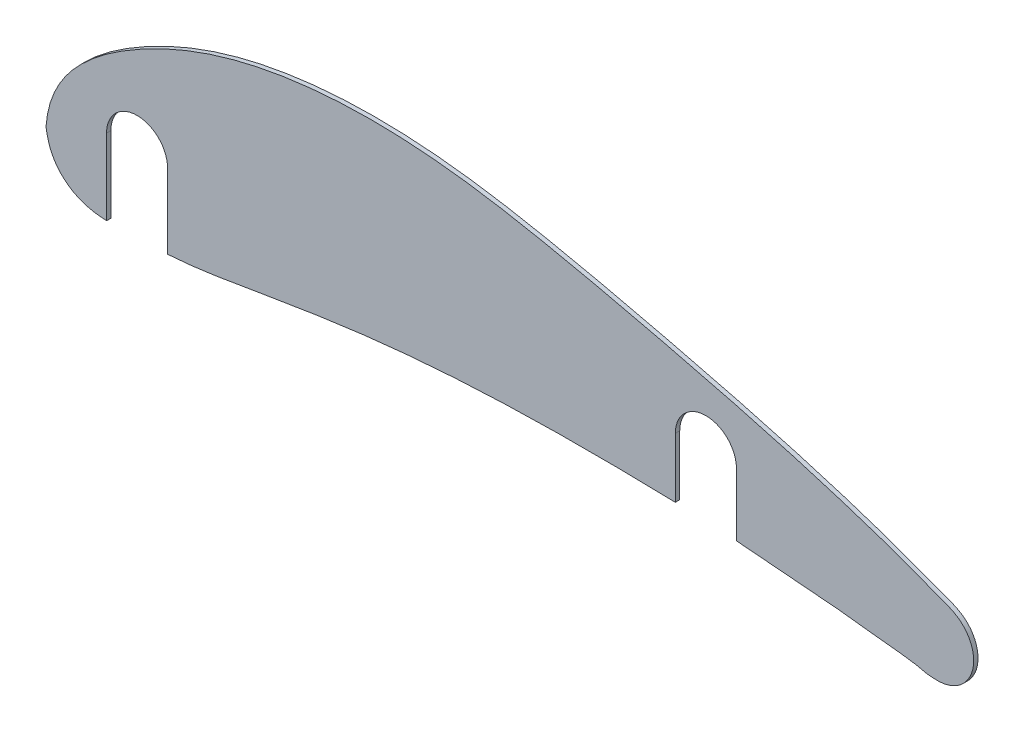
from build123d import *

# Parameters (mm, degrees)
BOSS_EXTRUDE1_DEPTH = 1.5875
SKETCH2_R           = 5
CUT_EXTRUDE1_DEPTH  = 4
BOSS_EXTRUDE2_START = -1.5875
SKETCH3_R           = 5
BOSS_EXTRUDE2_DEPTH = 1.5875
CUT_EXTRUDE2_DEPTH  = 1.5875


with BuildPart() as part:
    # Sketch1 → Boss-Extrude1 (new body)
    with BuildSketch(Plane.XY):
        with BuildLine():
            add(Edge.make_bspline(
                [(0.000560351, 0.000130087), (0.810633127, 7.359196055), (8.649092025, 17.856605174), (26.286719818, 29.975176328), (52.111128271, 42.069215275), (89.597618475, 49.290763054), (131.400792109, 47.884831915), (173.256699242, 40.041104278), (217.961060472, 29.612974894), (256.952064401, 19.528920948), (290.35983767, 8.71099439), (301.273197721, 4.382828139), (314.816918223, -0.516206742), (309.846313895, 0.000130087)],
                knots=[0, 0, 0, 0, 0.060863618, 0.113688265, 0.188608742, 0.312908923, 0.448482434, 0.557612135, 0.691544113, 0.852438279, 0.92975597, 0.976058229, 1, 1, 1, 1], degree=3))
            add(Edge.make_bspline(
                [(309.846313895, 0.000130087), (303.956832565, 1.47095521), (293.989507544, 2.093987313), (276.26402299, 4.514356704), (260.846344817, 5.427413394), (235.858814759, 7.870306192), (205.101424636, 8.838080282), (157.718638092, 9.030650149), (110.497331172, 6.181495223), (66.506197185, -0.586669107), (36.454672816, -6.098499901), (15.316603331, -6.189065841), (1.230714189, -6.924076091), (0.000560351, 0.000130087)],
                knots=[0, 0, 0, 0, 0.057787081, 0.095274891, 0.171021118, 0.205339302, 0.335319146, 0.464904334, 0.658702312, 0.785511947, 0.893517288, 0.94309214, 1, 1, 1, 1], degree=3))
        make_face()
    extrude(amount=BOSS_EXTRUDE1_DEPTH)

    # Sketch2 → Cut-Extrude1 (cut)
    with BuildSketch(Plane.XY.offset(1.5875)):
        with Locations((227.296313895, 19.050130087)):
            Circle(SKETCH2_R)
        with Locations((20.32, 10.16)):
            Circle(SKETCH2_R)
    extrude(amount=-CUT_EXTRUDE1_DEPTH, mode=Mode.SUBTRACT)

    # Sketch3 → Boss-Extrude2 (add)
    # profile 1 of 2: a face of its own
    with BuildSketch(Plane(origin=(0, 0, 0), x_dir=(-1, 0, 0), z_dir=(0, 0, -1)).offset(BOSS_EXTRUDE2_START)):
        with BuildLine():
            add(Edge.make_bspline(
                [(-307.640659198, -12.539087546), (-307.217558356, -12.433423344), (-306.794698745, -12.325307987), (-305.94757969, -12.12330096), (-305.523307874, -12.029535003), (-304.248687144, -11.766580558), (-303.396542737, -11.615636043), (-300.835174159, -11.21295058), (-299.121107841, -11.010410608), (-295.688964286, -10.646085532), (-293.970839392, -10.484784679), (-291.395439154, -10.22467467), (-290.537293617, -10.134707532), (-288.822043271, -9.944198445), (-287.964861558, -9.844437915), (-285.39405881, -9.537612889), (-283.681197538, -9.322828465), (-280.253975137, -8.908499626), (-278.539352749, -8.711609867), (-273.38915432, -8.185272474), (-269.948888995, -7.903472556), (-263.065636854, -7.367525768), (-259.622642312, -7.113457385), (-252.743642855, -6.534299134), (-249.308438171, -6.201078142), (-242.431016007, -5.605893048), (-238.987786484, -5.354212306), (-232.093485223, -4.930535427), (-228.641544528, -4.75746758), (-218.28592219, -4.32759383), (-211.381766601, -4.15969745), (-197.573132458, -3.918001938), (-190.668647472, -3.846076469), (-176.859186388, -3.845312431), (-169.95421005, -3.916543553), (-156.143612339, -4.246938801), (-149.234937909, -4.505545645), (-135.436938869, -5.236314206), (-128.547026917, -5.708365191), (-114.787919071, -6.895625055), (-107.918875215, -7.612618486), (-94.20369313, -9.315463639), (-87.358999715, -10.294378281), (-77.115816219, -11.889039149), (-73.704718185, -12.441665778), (-66.887436207, -13.578332899), (-63.482024188, -14.167402421), (-53.261994425, -15.909749635), (-46.44242034, -17.028905731), (-37.85333306, -17.987330435), (-36.13227452, -18.1567188), (-32.688374655, -18.439324462), (-30.964736841, -18.550600806), (-25.789066845, -18.799813385), (-22.332836764, -18.861587488), (-18.013816177, -18.964564881), (-17.150036808, -18.986391339), (-15.422588421, -19.035533108), (-14.558961918, -19.064963111), (-12.831389771, -19.107949046), (-11.967435293, -19.121065622), (-10.238782943, -19.110322287), (-9.374285952, -19.086464893), (-6.799982642, -18.935774333), (-5.1040529, -18.729672307), (-2.60606507, -18.181294881), (-1.781028788, -17.958760916), (-0.556909532, -17.554948104), (-0.151110885, -17.40866523), (0.655628102, -17.090782411), (1.058151158, -16.918409424), (3.033598156, -15.999239459), (4.496819541, -15.083862947), (6.165080649, -13.692542546), (6.491819622, -13.400643282), (7.122036025, -12.797069108), (7.425020518, -12.486058415), (8.298329375, -11.525908236), (8.833114996, -10.8497312), (9.565071132, -9.782041168), (9.797325866, -9.417219923), (10.238211241, -8.669604442), (10.447401936, -8.285671349), (11.035029394, -7.114520562), (11.370477668, -6.315183997), (11.937470931, -4.682242599), (12.168952201, -3.848616751), (12.442464761, -2.573867952), (12.517450612, -2.143613721), (12.670167609, -1.284010684), (12.746526108, -0.854209165), (12.822884607, -0.424407646)],
                knots=[0, 0, 0, 0, 0.00390625, 0.00390625, 0.0078125, 0.0078125, 0.015625, 0.015625, 0.03125, 0.03125, 0.046875, 0.046875, 0.0546875, 0.0546875, 0.0625, 0.0625, 0.078125, 0.078125, 0.09375, 0.09375, 0.125, 0.125, 0.15625, 0.15625, 0.1875, 0.1875, 0.21875, 0.21875, 0.25, 0.25, 0.3125, 0.3125, 0.375, 0.375, 0.4375, 0.4375, 0.5, 0.5, 0.5625, 0.5625, 0.625, 0.625, 0.6875, 0.6875, 0.71875, 0.71875, 0.75, 0.75, 0.8125, 0.8125, 0.828125, 0.828125, 0.84375, 0.84375, 0.875, 0.875, 0.8828125, 0.8828125, 0.890625, 0.890625, 0.8984375, 0.8984375, 0.90625, 0.90625, 0.921875, 0.921875, 0.9296875, 0.9296875, 0.93359375, 0.93359375, 0.9375, 0.9375, 0.953125, 0.953125, 0.95703125, 0.95703125, 0.9609375, 0.9609375, 0.96875, 0.96875, 0.97265625, 0.97265625, 0.9765625, 0.9765625, 0.984375, 0.984375, 0.9921875, 0.9921875, 0.99609375, 0.99609375, 1, 1, 1, 1], degree=3))
            add(Edge.make_bspline(
                [(12.822884607, -0.424407646), (12.765139792, 0.100172261), (12.707394977, 0.624752169), (12.591905347, 1.673911984), (12.52891567, 2.197119212), (12.297914412, 3.755740267), (12.098640002, 4.782972021), (11.366701381, 7.829566749), (10.700090591, 9.813873371), (9.645780575, 12.236404594), (9.423338741, 12.719055064), (8.958881373, 13.673430352), (8.23447829, 15.08562207), (7.430656328, 16.442308561), (5.726221645, 19.088035245), (4.460833832, 20.761627444), (2.403164216, 23.160481023), (1.688839251, 23.943369949), (0.222028874, 25.466851836), (-2.030148044, 27.684033496), (-4.41064195, 29.733189538), (-9.316761854, 33.641457343), (-12.781484695, 35.992965612), (-18.164651713, 39.27656059), (-19.990377965, 40.333355187), (-23.666133339, 42.357961339), (-25.520275615, 43.327279207), (-31.130467721, 46.108995357), (-34.93418714, 47.795409072), (-46.531537172, 52.362569414), (-54.515154512, 54.741205672), (-63.744755219, 56.761657049), (-64.774723341, 56.977238408), (-66.834788658, 57.389176151), (-69.925830231, 57.978474657), (-73.019609651, 58.484766764), (-79.210596391, 59.393423564), (-83.34248448, 59.860835126), (-95.750370075, 60.892542115), (-104.038590609, 61.086258338), (-116.492008775, 60.737503457), (-120.646670589, 60.514458534), (-126.883586466, 60.030630314), (-128.963379302, 59.844466803), (-133.124550465, 59.424070644), (-135.207540526, 59.189544115), (-145.594970482, 57.905779676), (-153.832792977, 56.524741453), (-166.132564079, 54.17356844), (-170.223049115, 53.343512008), (-178.393757628, 51.633027655), (-182.473713838, 50.751287787), (-194.700002507, 48.039407471), (-202.832778155, 46.142719954), (-215.014339388, 43.211283588), (-219.072180538, 42.2209863), (-227.182053622, 40.211875691), (-231.232225779, 39.191799725), (-243.36199815, 36.064182322), (-251.420235834, 33.887176959), (-263.448276276, 30.428836901), (-267.447887219, 29.244406312), (-275.426612854, 26.808913408), (-279.40618455, 25.559336773), (-285.35715209, 23.625187338), (-287.337685563, 22.970320262), (-291.290499883, 21.633757462), (-293.262858235, 20.952313697), (-297.195026702, 19.548632822), (-299.153208366, 18.821101737), (-303.064502528, 17.349560104), (-305.0190352, 16.610166429), (-307.955050529, 15.51478285), (-308.934285457, 15.151485754), (-310.893891195, 14.428584226), (-311.875164589, 14.071914027), (-313.831366034, 13.337945403), (-314.808049131, 12.961388245), (-316.719156906, 12.12649388), (-317.652282104, 11.663851008), (-318.978024645, 10.820880812), (-319.408221872, 10.51489925), (-320.225847261, 9.859622762), (-320.615306755, 9.509314527), (-321.353583055, 8.761089941), (-321.699471113, 8.365825169), (-322.336708966, 7.543445692), (-322.629515882, 7.114906521), (-323.16319448, 6.222920138), (-323.404365456, 5.758838065), (-323.831166845, 4.79677466), (-324.194764938, 3.818521185), (-324.436422233, 2.809031523), (-324.571585545, 2.040110573), (-324.608939896, 1.781831147), (-324.667931422, 1.261246203), (-324.689573785, 0.998141034), (-324.756720117, -0.310913388), (-324.682639527, -1.346678633), (-324.382280636, -2.883329873), (-324.249021416, -3.39559158), (-323.924248204, -4.388644661), (-323.541036888, -5.35507277), (-323.0431311, -6.269244957), (-322.625572759, -6.934768493), (-322.478484529, -7.153933608), (-322.172908527, -7.580241987), (-322.014249177, -7.787766025), (-321.192214147, -8.79782852), (-320.443866507, -9.518885707), (-318.761163886, -10.782634014), (-317.8577056, -11.301394678), (-316.421060308, -11.913302637), (-315.925392414, -12.090300006), (-314.917821884, -12.383866446), (-314.409413715, -12.499760473), (-313.383993339, -12.674058303), (-312.866960582, -12.732324794), (-311.825105731, -12.796811206), (-311.298814045, -12.802807669), (-310.250395164, -12.774737499), (-309.727518722, -12.741201694), (-308.683355881, -12.650868989), (-308.162125238, -12.593256437), (-307.640659198, -12.539087546)],
                knots=[0, 0, 0, 0, 0.00390625, 0.00390625, 0.0078125, 0.0078125, 0.015625, 0.015625, 0.03125, 0.03125, 0.03515625, 0.03515625, 0.0390625, 0.046875, 0.046875, 0.0625, 0.0625, 0.0703125, 0.0703125, 0.078125, 0.09375, 0.09375, 0.125, 0.125, 0.140625, 0.140625, 0.15625, 0.15625, 0.1875, 0.1875, 0.25, 0.25, 0.2578125, 0.2578125, 0.265625, 0.28125, 0.28125, 0.3125, 0.3125, 0.375, 0.375, 0.40625, 0.40625, 0.421875, 0.421875, 0.4375, 0.4375, 0.5, 0.5, 0.53125, 0.53125, 0.5625, 0.5625, 0.625, 0.625, 0.65625, 0.65625, 0.6875, 0.6875, 0.75, 0.75, 0.78125, 0.78125, 0.8125, 0.8125, 0.828125, 0.828125, 0.84375, 0.84375, 0.859375, 0.859375, 0.875, 0.875, 0.8828125, 0.8828125, 0.890625, 0.890625, 0.8984375, 0.8984375, 0.90625, 0.90625, 0.91015625, 0.91015625, 0.9140625, 0.9140625, 0.91796875, 0.91796875, 0.921875, 0.921875, 0.92578125, 0.92578125, 0.9296875, 0.93359375, 0.93359375, 0.935546875, 0.935546875, 0.9375, 0.9375, 0.9453125, 0.9453125, 0.94921875, 0.94921875, 0.953125, 0.95703125, 0.95703125, 0.958984375, 0.958984375, 0.9609375, 0.9609375, 0.96875, 0.96875, 0.9765625, 0.9765625, 0.98046875, 0.98046875, 0.984375, 0.984375, 0.98828125, 0.98828125, 0.9921875, 0.9921875, 0.99609375, 0.99609375, 1, 1, 1, 1], degree=3))
        make_face()
        with BuildLine():
            add(Edge.make_bspline(
                [(-309.846313895, 0.000130087), (-303.956832565, 1.47095521), (-293.989507544, 2.093987313), (-276.26402299, 4.514356704), (-260.846344817, 5.427413394), (-235.858814759, 7.870306192), (-205.101424636, 8.838080282), (-157.718638092, 9.030650149), (-110.497331172, 6.181495223), (-66.506197185, -0.586669107), (-36.454672816, -6.098499901), (-15.316603331, -6.189065841), (-1.230714189, -6.924076091), (-0.000560351, 0.000130087)],
                knots=[0, 0, 0, 0, 0.057787081, 0.095274891, 0.171021118, 0.205339302, 0.335319146, 0.464904334, 0.658702312, 0.785511947, 0.893517288, 0.94309214, 1, 1, 1, 1], degree=3))
            add(Edge.make_bspline(
                [(-0.000560351, 0.000130087), (-0.810633127, 7.359196055), (-8.649092025, 17.856605174), (-26.286719818, 29.975176328), (-52.111128271, 42.069215275), (-89.597618475, 49.290763054), (-131.400792109, 47.884831915), (-173.256699242, 40.041104278), (-217.961060472, 29.612974894), (-256.952064401, 19.528920948), (-290.35983767, 8.71099439), (-301.273197721, 4.382828139), (-314.816918223, -0.516206742), (-309.846313895, 0.000130087)],
                knots=[0, 0, 0, 0, 0.060863618, 0.113688265, 0.188608742, 0.312908923, 0.448482434, 0.557612135, 0.691544113, 0.852438279, 0.92975597, 0.976058229, 1, 1, 1, 1], degree=3))
        make_face(mode=Mode.SUBTRACT)
    # profile 2 of 2: a face of its own
    with BuildSketch(Plane(origin=(0, 0, 0), x_dir=(-1, 0, 0), z_dir=(0, 0, -1)).offset(BOSS_EXTRUDE2_START)):
        with BuildLine():
            add(Edge.make_bspline(
                [(-0.000560351, 0.000130087), (-0.810633127, 7.359196055), (-8.649092025, 17.856605174), (-26.286719818, 29.975176328), (-52.111128271, 42.069215275), (-89.597618475, 49.290763054), (-131.400792109, 47.884831915), (-173.256699242, 40.041104278), (-217.961060472, 29.612974894), (-256.952064401, 19.528920948), (-290.35983767, 8.71099439), (-301.273197721, 4.382828139), (-314.816918223, -0.516206742), (-309.846313895, 0.000130087)],
                knots=[0, 0, 0, 0, 0.060863618, 0.113688265, 0.188608742, 0.312908923, 0.448482434, 0.557612135, 0.691544113, 0.852438279, 0.92975597, 0.976058229, 1, 1, 1, 1], degree=3))
            add(Edge.make_bspline(
                [(-309.846313895, 0.000130087), (-303.956832565, 1.47095521), (-293.989507544, 2.093987313), (-276.26402299, 4.514356704), (-260.846344817, 5.427413394), (-235.858814759, 7.870306192), (-205.101424636, 8.838080282), (-157.718638092, 9.030650149), (-110.497331172, 6.181495223), (-66.506197185, -0.586669107), (-36.454672816, -6.098499901), (-15.316603331, -6.189065841), (-1.230714189, -6.924076091), (-0.000560351, 0.000130087)],
                knots=[0, 0, 0, 0, 0.057787081, 0.095274891, 0.171021118, 0.205339302, 0.335319146, 0.464904334, 0.658702312, 0.785511947, 0.893517288, 0.94309214, 1, 1, 1, 1], degree=3))
        make_face()
        with Locations(Location((-20.32, 10.16, 0), (0, 0, 180))):
            Circle(SKETCH3_R, mode=Mode.SUBTRACT)
        with Locations(Location((-227.296313895, 19.050130087, 0), (0, 0, 180))):
            Circle(SKETCH3_R, mode=Mode.SUBTRACT)
    extrude(amount=BOSS_EXTRUDE2_DEPTH)

    # Sketch4 → Cut-Extrude2 (cut)
    with BuildSketch(Plane.XY.offset(1.5875)):
        with BuildLine():
            Line((9.2075, -29.5275), (9.2075, 8.5725))
            ThreePointArc((9.2075, 8.5725), (20.32, 19.685), (31.4325, 8.5725))
            Line((31.4325, 8.5725), (31.4325, -29.5275))
            Line((31.4325, -29.5275), (9.2075, -29.5275))
        make_face()
        with BuildLine():
            Line((216.183813895, 17.462630087), (216.183813895, -35.788115321))
            Line((216.183813895, -35.788115321), (238.408813895, -35.788115321))
            Line((238.408813895, -35.788115321), (238.408813895, 17.462630087))
            ThreePointArc((238.408813895, 17.462630087), (227.296313895, 28.575130087), (216.183813895, 17.462630087))
        make_face()
    extrude(amount=-CUT_EXTRUDE2_DEPTH, mode=Mode.SUBTRACT)


solid = part.part
